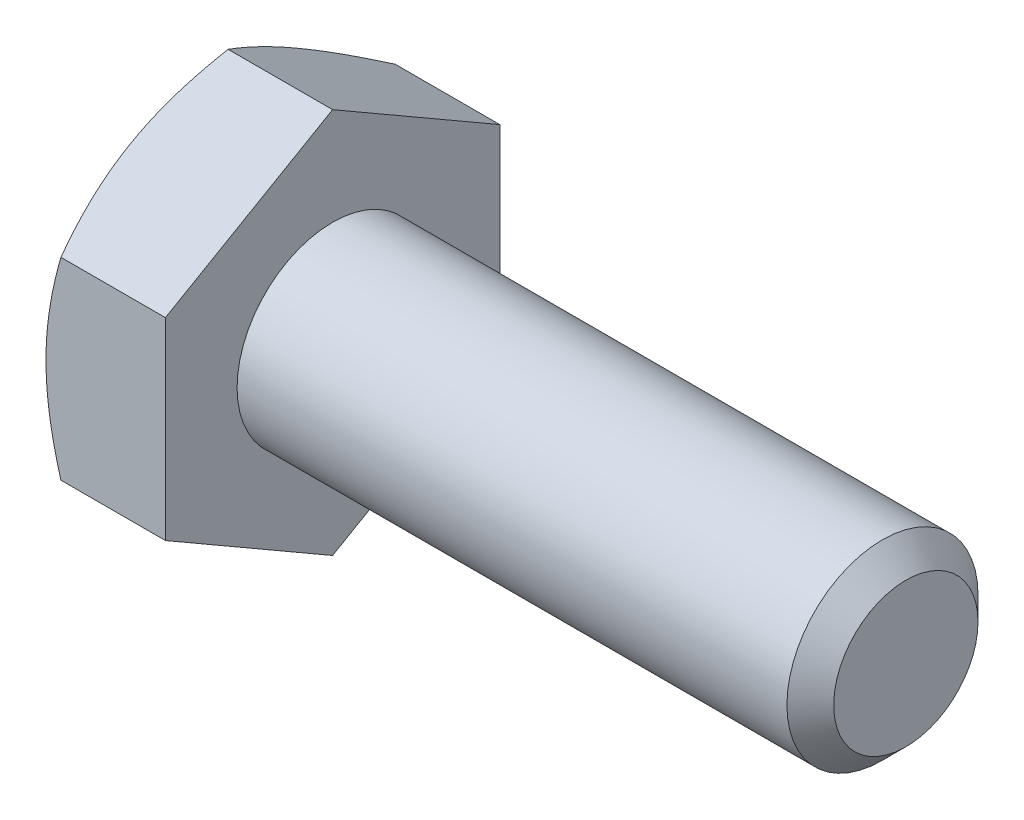
from build123d import *

# Parameters (mm, degrees)
SKETCH5_R           = 3.175
BOSS_EXTRUDE3_DEPTH = 19.05
CHAMFER1_SIZE       = 0.77724
BOSS_EXTRUDE4_DEPTH = 3.96875
SKETCH8_OUTSIDE_W   = 107.284
SKETCH8_OUTSIDE_H   = 109.004
SKETCH8_OUTSIDE_R   = 5.55625
CUT_EXTRUDE3_DEPTH  = 25.533595695
CUT_EXTRUDE3_DRAFT  = -60
CUT_EXTRUDE4_DEPTH  = 0.254
CIRPATTERN1_COUNT   = 3


with BuildPart() as part:
    # Sketch5 → Boss-Extrude3 (new body)
    with BuildSketch(Plane(origin=(11.509375, 0, 0), x_dir=(0, 0, -1), z_dir=(1, 0, 0))):
        Circle(SKETCH5_R)
    extrude(amount=-BOSS_EXTRUDE3_DEPTH)

    # Chamfer1
    chamfer1_edges = [part.edges().sort_by_distance(p)[0] for p in [
        (11.509375, 0, 3.175),
    ]]
    chamfer(chamfer1_edges, length=CHAMFER1_SIZE)

    # Sketch6 → Boss-Extrude4 (add)
    with BuildSketch(Plane.ZY.offset(7.540625)):
        Polygon((5.55625, 3.207902433), (0, 6.415804866), (-5.55625, 3.207902433), (-5.55625, -3.207902433), (0, -6.415804866), (5.55625, -3.207902433), align=None)
    extrude(amount=BOSS_EXTRUDE4_DEPTH)


with BuildPart() as cut_extrude3_tool:
    # Sketch8 outside → Cut-Extrude3 (with draft: the straight prism first)
    with BuildSketch(Plane.ZY.offset(11.509375)):
        Rectangle(SKETCH8_OUTSIDE_W, SKETCH8_OUTSIDE_H)
        Circle(SKETCH8_OUTSIDE_R, mode=Mode.SUBTRACT)
    extrude(amount=-CUT_EXTRUDE3_DEPTH)
    # Cut-Extrude3: the draft: its side faces are tilted about the plane it starts from
    cut_extrude3_sides = [cut_extrude3_tool.faces().sort_by_distance(p)[0] for p in [
        (1.257422847, -54.502, 0),
        (1.257422847, 0, 53.642),
        (1.257422847, 54.502, 0),
        (1.257422847, 0, -53.642),
        (1.257422847, 0, -5.55625),
    ]]
    draft(cut_extrude3_sides, Plane.ZY.offset(11.509375), CUT_EXTRUDE3_DRAFT)


with BuildPart() as part_1:
    add(part.part)

    # Cut-Extrude3: cut by cut_extrude3_tool
    add(cut_extrude3_tool.part, mode=Mode.SUBTRACT)

    # Sketch12 → Cut-Extrude4 (cut)
    with BuildSketch(Plane.ZY.offset(11.509375)):
        with BuildLine():
            Line((0.1666875, 4.2783125), (0.1666875, 2.3891875))
            ThreePointArc((0.1666875, 2.3891875), (0, 2.2225), (-0.1666875, 2.3891875))
            Line((-0.1666875, 2.3891875), (-0.1666875, 4.2783125))
            ThreePointArc((-0.1666875, 4.2783125), (0, 4.445), (0.1666875, 4.2783125))
        make_face()
    cut_extrude4 = extrude(amount=-CUT_EXTRUDE4_DEPTH, mode=Mode.SUBTRACT)

    # CirPattern1: Cut-Extrude4 ×3 about axis
    cirpattern1_axis = Axis((0, 0, 0), (1, 0, 0))
    for i in range(1, CIRPATTERN1_COUNT):
        add(cut_extrude4.rotate(cirpattern1_axis, i * 360 / CIRPATTERN1_COUNT), mode=Mode.SUBTRACT)


solid = part_1.part
